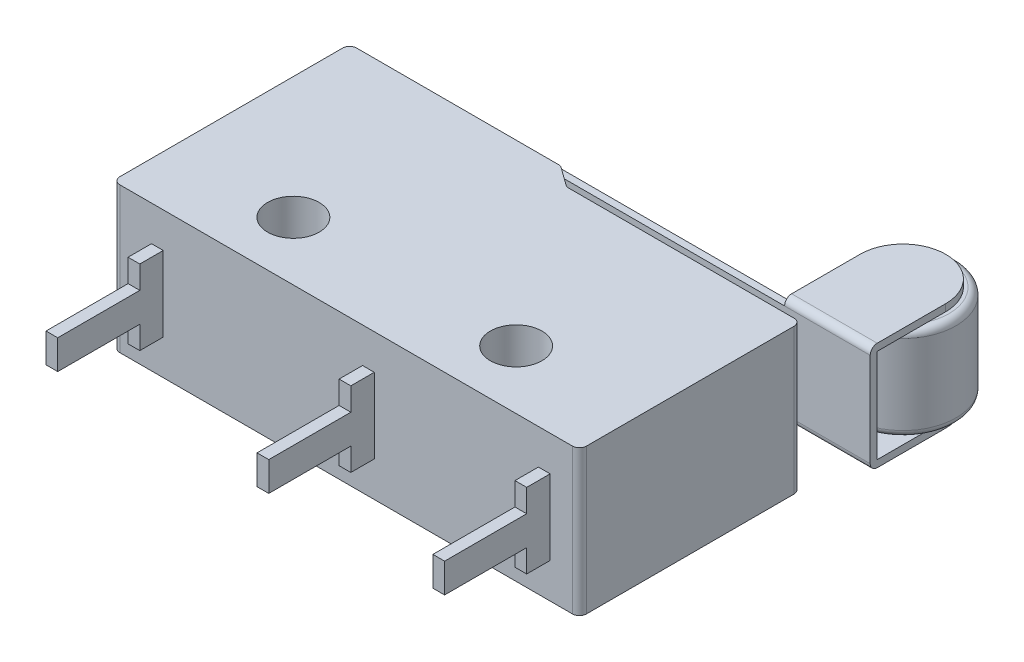
from build123d import *

# Parameters (mm, degrees)
BOSS_EXTRU_1_DEPTH           = 3.1
CONG_1_R                     = 0.3
ENL_V_MAT_EXTRU_2_DEPTH      = 12.580803081
ENL_V_MAT_EXTRU_2_DEPTH_BACK = 12.580803081
ESQUISSE2_R                  = 1.1
BOSS_EXTRU_2_DEPTH           = 2
BOSS_EXTRU_3_DEPTH           = 0.3
CONG_2_R                     = 0.3
CONG_2_OF_SYM_TRIE1_R        = 0.3
BOSS_EXTRU_5_DEPTH           = 0.25
R_P_TITION_LIN_AIRE1_COUNT   = 2
R_P_TITION_LIN_AIRE1_PITCH   = 7.5
R_P_TITION_LIN_AIRE2_COUNT   = 2
R_P_TITION_LIN_AIRE2_PITCH   = 16.5


with BuildPart() as part:
    # Esquisse1 → Boss.-Extru.1 (new, symmetric)
    with BuildSketch(Plane(origin=(0, 0, 0), x_dir=(1, 0, 0), z_dir=(0, 1, 0))):
        Polygon((-9.95, -5.05), (-9.95, 5.05), (-0.95, 5.05), (-0.05, 4.4), (9.95, 4.4), (9.95, -5.05), align=None)
    extrude(amount=BOSS_EXTRU_1_DEPTH, both=True)

    # Congé1
    cong_1_edges = [part.edges().sort_by_distance(p)[0] for p in [
        (-9.95, 0, 5.05),
        (-9.95, 0, -5.05),
        (-0.95, 0, -5.05),
        (-0.05, 0, -4.4),
        (9.95, 0, -4.4),
        (9.95, 0, 5.05),
    ]]
    fillet(cong_1_edges, radius=CONG_1_R)

    # Esquisse2 → Enlèv. mat.-Extru.2 (cut, two sides: drawn at the far end of the back side and taken through both)
    with BuildSketch(Plane(origin=(0, 0, 0), x_dir=(1, 0, 0), z_dir=(0, 1, 0)).offset(-ENL_V_MAT_EXTRU_2_DEPTH_BACK)):
        with Locations(Location((-4.75, -2.55, 0), (0, 0, 90))):
            Circle(ESQUISSE2_R)
        with Locations(Location((4.75, -2.55, 0), (0, 0, 90))):
            Circle(ESQUISSE2_R)
    extrude(amount=ENL_V_MAT_EXTRU_2_DEPTH + ENL_V_MAT_EXTRU_2_DEPTH_BACK, mode=Mode.SUBTRACT)

    # Esquisse3 → Boss.-Extru.2 (add, symmetric)
    with BuildSketch(Plane(origin=(0, 0, 0), x_dir=(1, 0, 0), z_dir=(0, 1, 0))):
        with BuildLine():
            Line((-7.45, 5.05), (-7.45, 5.595028059))
            ThreePointArc((-7.45, 5.595028059), (-7.316741804, 5.916741804), (-6.995028059, 6.05))
            Line((-6.995028059, 6.05), (11.55, 6.05))
            Line((11.55, 6.05), (11.55, 5.75))
            Line((11.55, 5.75), (-6.9950313, 5.75))
            ThreePointArc((-6.9950313, 5.75), (-7.104610915, 5.704608624), (-7.15, 5.595028059))
            Line((-7.15, 5.595028059), (-7.15, 5.05))
            Line((-7.15, 5.05), (-7.45, 5.05))
        make_face()
    extrude(amount=BOSS_EXTRU_2_DEPTH, both=True)

    # Esquisse4 → Boss.-Extru.3 (add)
    with BuildSketch(Plane(origin=(0, 2, 0), x_dir=(1, 0, 0), z_dir=(0, 1, 0))):
        with BuildLine():
            Line((11.55, 5.75), (11.55, 8.97))
            ThreePointArc((11.55, 8.97), (9.725, 10.795), (7.9, 8.97))
            Line((7.9, 8.97), (7.9, 5.75))
            Line((7.9, 5.75), (11.55, 5.75))
        make_face()
    boss_extru_3 = extrude(amount=BOSS_EXTRU_3_DEPTH)

    # Congé2
    cong_2_edges = [part.edges().sort_by_distance(p)[0] for p in [
        (9.725, 2.3, -5.75),
    ]]
    fillet(cong_2_edges, radius=CONG_2_R)

    # Symétrie1: Boss.-Extru.3 across plane
    add(boss_extru_3.mirror(Plane.ZX))

    # Congé2 of Symétrie1
    cong_2_of_sym_trie1_edges = [part.edges().sort_by_distance(p)[0] for p in [
        (9.725, -2.3, -5.75),
    ]]
    fillet(cong_2_of_sym_trie1_edges, radius=CONG_2_OF_SYM_TRIE1_R)

    # Esquisse6 → Révolution1 (revolve)
    with BuildSketch(Plane.XY.offset(-8.97), mode=Mode.PRIVATE) as r_volution1_sk:
        with BuildLine():
            Line((9.725, 2), (9.725, -2))
            Line((9.725, -2), (11.69, -2))
            ThreePointArc((11.69, -2), (11.902132034, -1.912132034), (11.99, -1.7))
            Line((11.99, -1.7), (11.99, 1.7))
            ThreePointArc((11.99, 1.7), (11.902132034, 1.912132034), (11.69, 2))
            Line((11.69, 2), (9.725, 2))
        make_face()
    revolve(r_volution1_sk.sketch.rotate(Axis((9.725, 2, -8.97), (0, -1, 0)), 90), axis=Axis((9.725, 2, -8.97), (0, -1, 0)))

    # Esquisse7 → Boss.-Extru.5 (add, symmetric)
    with BuildSketch(Plane(origin=(8.45, 0, 0), x_dir=(0, 0, -1), z_dir=(1, 0, 0))):
        Polygon((-5.05, 1.6), (-5.05, -1.6), (-6.05, -1.6), (-6.05, -0.625), (-9.55, -0.625), (-9.55, 0.625), (-6.05, 0.625), (-6.05, 1.6), align=None)
    boss_extru_5 = extrude(amount=BOSS_EXTRU_5_DEPTH, both=True)

    # Répétition linéaire1: Boss.-Extru.5 ×2
    with Locations(*[(-i * R_P_TITION_LIN_AIRE1_PITCH, 0, 0) for i in range(1, R_P_TITION_LIN_AIRE1_COUNT)]):
        add(boss_extru_5)

    # Répétition linéaire2: Boss.-Extru.5 ×2
    with Locations(*[(-i * R_P_TITION_LIN_AIRE2_PITCH, 0, 0) for i in range(1, R_P_TITION_LIN_AIRE2_COUNT)]):
        add(boss_extru_5)


solid = part.part
